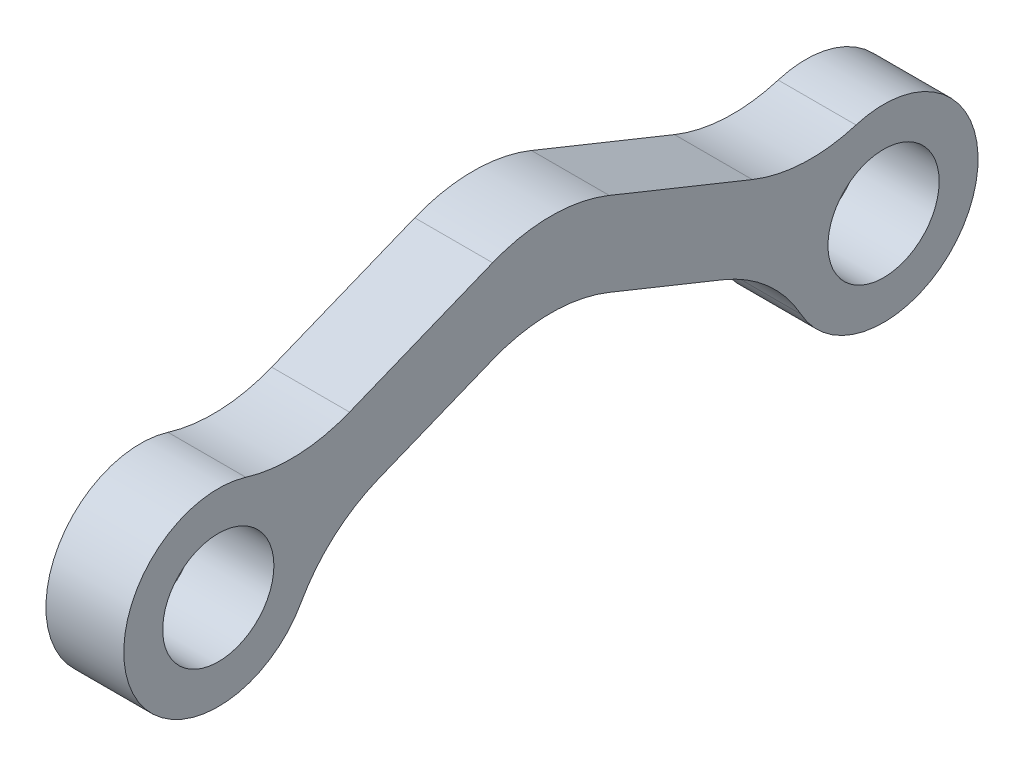
from build123d import *

# Parameters (mm, degrees)
SKETCH1_R           = 3.57
BOSS_EXTRUDE1_DEPTH = 5


with BuildPart() as part:
    # Sketch1 → Boss-Extrude1 (new body)
    with BuildSketch(Plane(origin=(0, 0, 0), x_dir=(0, 0, -1), z_dir=(1, 0, 0))):
        with BuildLine():
            Line((-34.292652671, 6.101206192), (-25.106065934, 9.812828159))
            ThreePointArc((-25.106065934, 9.812828159), (-21.36, 10.540989614), (-17.613934066, 9.812828159))
            Line((-17.613934066, 9.812828159), (-8.427347329, 6.101206192))
            ThreePointArc((-8.427347329, 6.101206192), (-5.123042901, 5.382807164), (-1.768225144, 5.806744341))
            ThreePointArc((-1.768225144, 5.806744341), (5.628005997, -2.273862022), (-5.305658284, -2.948709917))
            ThreePointArc((-5.305658284, -2.948709917), (-7.424420711, -0.313302797), (-10.300380296, 1.465286919))
            Line((-10.300380296, 1.465286919), (-17.613934066, 4.420154446))
            ThreePointArc((-17.613934066, 4.420154446), (-21.36, 5.1483159), (-25.106065934, 4.420154446))
            Line((-25.106065934, 4.420154446), (-32.419619704, 1.465286919))
            ThreePointArc((-32.419619704, 1.465286919), (-35.295579289, -0.313302797), (-37.414341716, -2.948709917))
            ThreePointArc((-37.414341716, -2.948709917), (-48.348005997, -2.273862022), (-40.951774856, 5.806744341))
            ThreePointArc((-40.951774856, 5.806744341), (-37.596957099, 5.382807164), (-34.292652671, 6.101206192))
        make_face()
        Circle(SKETCH1_R, mode=Mode.SUBTRACT)
        with Locations((-42.72, 0)):
            Circle(SKETCH1_R, mode=Mode.SUBTRACT)
    extrude(amount=BOSS_EXTRUDE1_DEPTH)


solid = part.part
